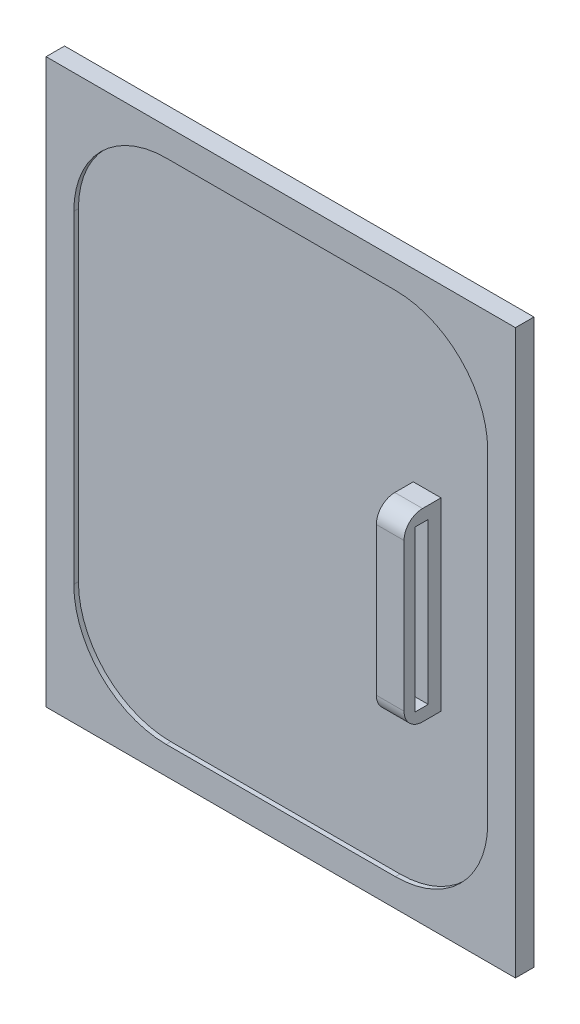
from build123d import *

# Parameters (mm, degrees)
SKETCH1_W               = 254
SKETCH1_H               = 304.8
BOSS_EXTRUDE1_DEPTH     = 10
CUT_EXTRUDE1_DEPTH      = 2.5
SKETCH3_W               = 15
SKETCH3_H               = 100
BOSS_EXTRUDE2_DEPTH     = 20
CUT_EXTRUDE4_DEPTH      = 262.907148317
CUT_EXTRUDE4_DEPTH_BACK = 262.907148317
SKETCH4_W               = 7.192307822
SKETCH4_H               = 86.692915772
FILLET2_R               = 10


with BuildPart() as part:
    # Sketch1 → Boss-Extrude1 (new body)
    with BuildSketch(Plane.XY):
        Rectangle(SKETCH1_W, SKETCH1_H)
    extrude(amount=BOSS_EXTRUDE1_DEPTH)

    # Sketch2 → Cut-Extrude1 (cut)
    with BuildSketch(Plane.XY.offset(10)):
        with BuildLine():
            Line((-62, -137.4), (62, -137.4))
            ThreePointArc((62, -137.4), (97.355339059, -122.755339059), (112, -87.4))
            Line((112, -87.4), (112, 87.4))
            ThreePointArc((112, 87.4), (97.355339059, 122.755339059), (62, 137.4))
            Line((62, 137.4), (-62, 137.4))
            ThreePointArc((-62, 137.4), (-97.355339059, 122.755339059), (-112, 87.4))
            Line((-112, 87.4), (-112, -87.4))
            ThreePointArc((-112, -87.4), (-97.355339059, -122.755339059), (-62, -137.4))
        make_face()
    extrude(amount=-CUT_EXTRUDE1_DEPTH, mode=Mode.SUBTRACT)

    # Sketch3 → Boss-Extrude2 (add)
    with BuildSketch(Plane.XY.offset(7.5)):
        with Locations((76.718712096, 0)):
            Rectangle(SKETCH3_W, SKETCH3_H)
    extrude(amount=BOSS_EXTRUDE2_DEPTH)

    # Sketch4 → Cut-Extrude4 (cut, two sides: drawn at the far end of the back side and taken through both)
    with BuildSketch(Plane(origin=(84.218712096, 0, 0), x_dir=(0, 0, -1), z_dir=(1, 0, 0)).offset(-CUT_EXTRUDE4_DEPTH_BACK)):
        with Locations((-18.014845045, 0)):
            Rectangle(SKETCH4_W, SKETCH4_H)
    extrude(amount=CUT_EXTRUDE4_DEPTH + CUT_EXTRUDE4_DEPTH_BACK, mode=Mode.SUBTRACT)

    # Fillet2
    fillet2_edges = [part.edges().sort_by_distance(p)[0] for p in [
        (76.718712096, 50, 27.5),
        (76.718712096, -50, 27.5),
    ]]
    fillet(fillet2_edges, radius=FILLET2_R)


solid = part.part
